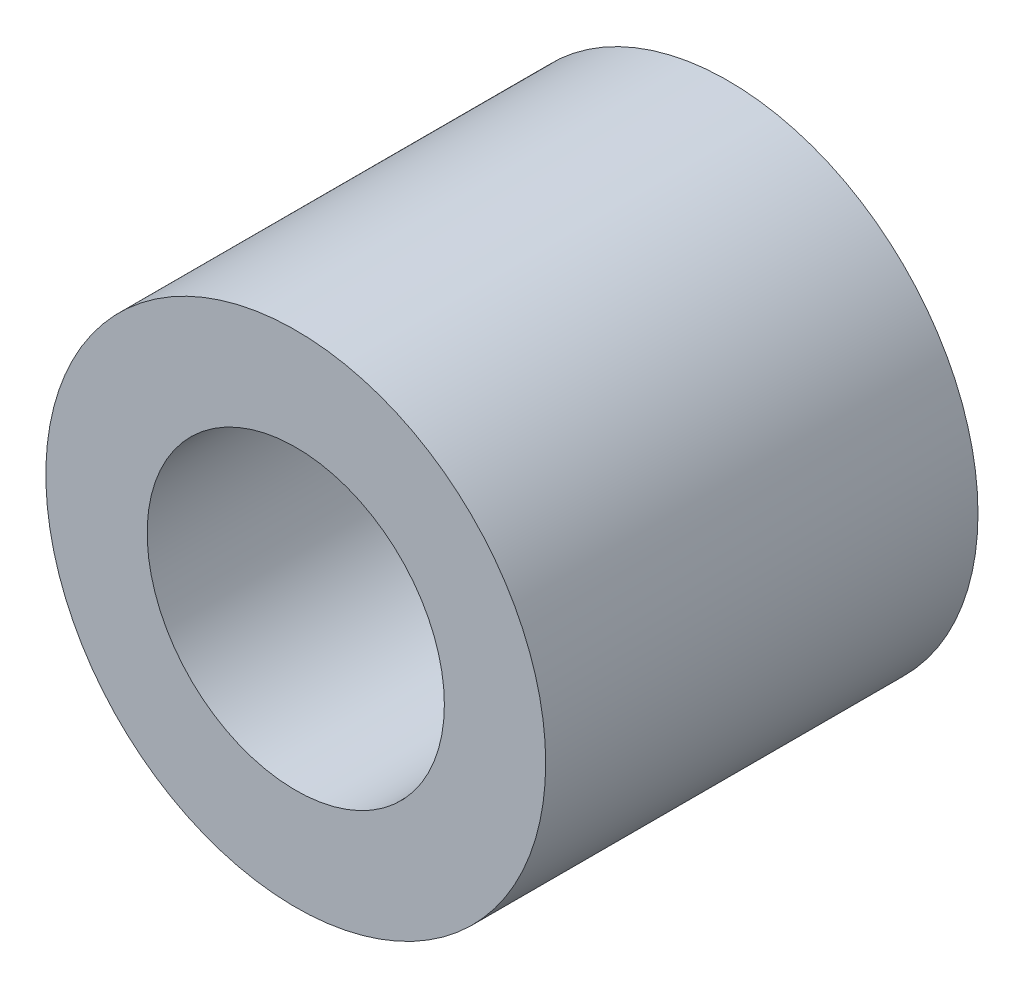
from build123d import *

# Parameters (mm, degrees)
SKETCH1_R           = 9.25
SKETCH1_R_2         = 5.5
BOSS_EXTRUDE1_DEPTH = 16
SKETCH1_2_R         = 9.25
SKETCH1_2_R_2       = 5.5
BOSS_EXTRUDE2_DEPTH = 1.5


with BuildPart() as part:
    # Sketch1 → Boss-Extrude1 (new body)
    with BuildSketch(Plane.XY):
        Circle(SKETCH1_R)
        Circle(SKETCH1_R_2, mode=Mode.SUBTRACT)
    extrude(amount=BOSS_EXTRUDE1_DEPTH)

    # Sketch1<2> → Boss-Extrude2 (add)
    with BuildSketch(Plane.XY):
        Circle(SKETCH1_2_R)
        Circle(SKETCH1_2_R_2, mode=Mode.SUBTRACT)
    extrude(amount=BOSS_EXTRUDE2_DEPTH)


solid = part.part
